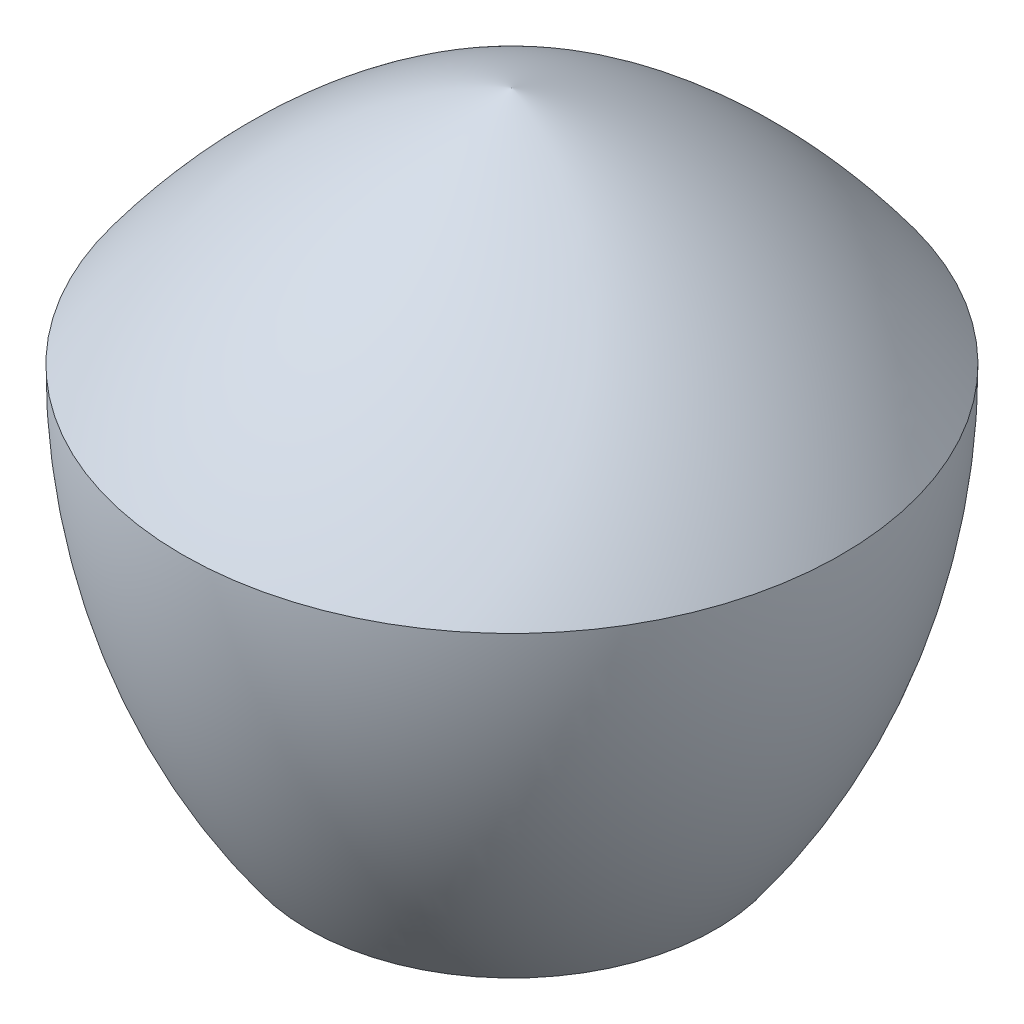
from build123d import *

# Parameters (mm, degrees)
SCALE1_SCALE = 0.5


with BuildPart() as part:
    # Sketch1 → Revolve1 (revolve)
    with BuildSketch(Plane.XY, mode=Mode.PRIVATE) as revolve1_sk:
        with BuildLine():
            Line((0, 26.286555606), (0, -23.713444394))
            ThreePointArc((0, -23.713444394), (7.821723252, -23.097861424), (15.450849719, -21.266270209))
            ThreePointArc((15.450849719, -21.266270209), (22.552825815, -7.327857313), (25, 8.122992406))
            ThreePointArc((25, 8.122992406), (13.938412896, 19.18457951), (0, 26.286555606))
        make_face()
    revolve(revolve1_sk.sketch.rotate(Axis((0, 55.76735263, 0), (0, -1, 0)), 90), axis=Axis((0, 55.76735263, 0), (0, -1, 0)))


with BuildPart() as part_1:
    # Scale1: scaled about (0, -0.152630804, 0)
    add(part.part.scale(SCALE1_SCALE).moved(Location((0, -0.076315402, 0))))


solid = part_1.part
